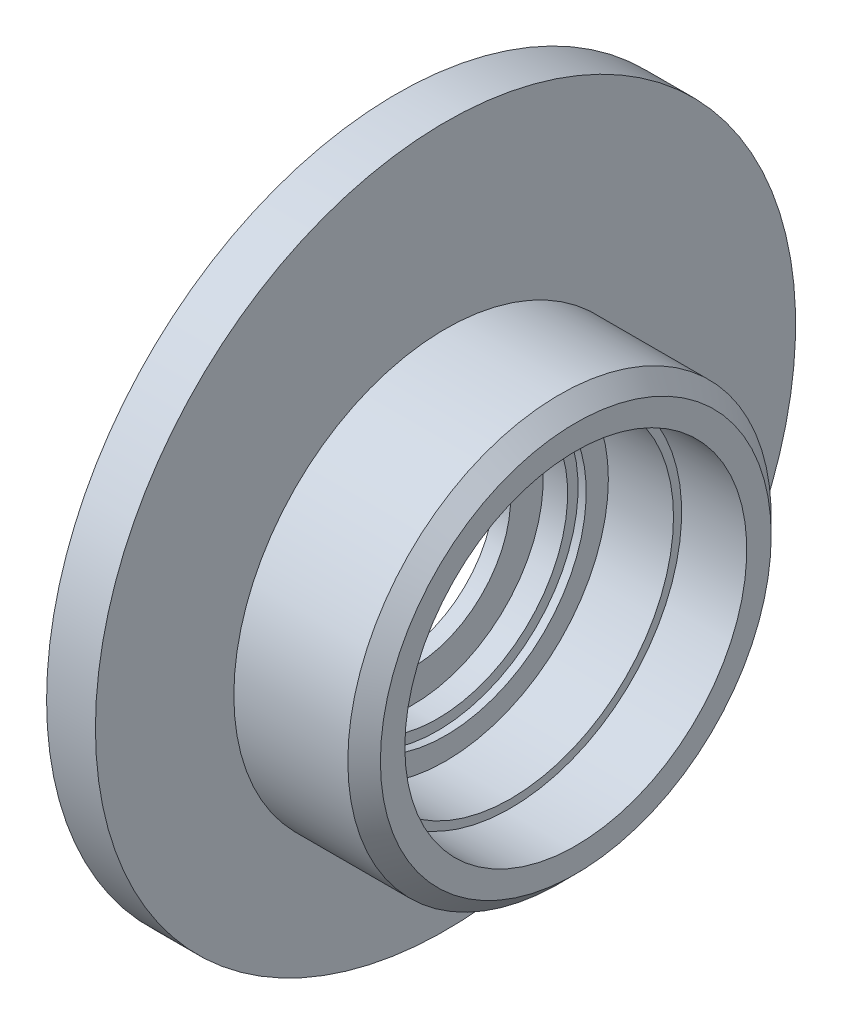
from build123d import *

# Parameters (mm, degrees)
ESQUISSE2_R        = 43
ESQUISSE2_R_2      = 17.284931715
BOSS_EXTRU_1_DEPTH = 6


with BuildPart() as part:
    # Esquisse1 → Base-Révolution (revolve)
    with BuildSketch(Plane.XY):
        Polygon((0, 12), (0, 26), (20, 26), (22, 24), (22, 21), (14, 21), (14, 20), (5, 20), (5, 16), (2, 16), (2, 12), align=None)
    revolve(axis=Axis((-4.169000368, 0, 0), (1, 0, 0)))

    # Esquisse2 → Boss.-Extru.1 (add)
    with BuildSketch(Plane.ZY):
        with Locations((0, 5)):
            Circle(ESQUISSE2_R)
        Circle(ESQUISSE2_R_2, mode=Mode.SUBTRACT)
    extrude(amount=-BOSS_EXTRU_1_DEPTH)


solid = part.part
